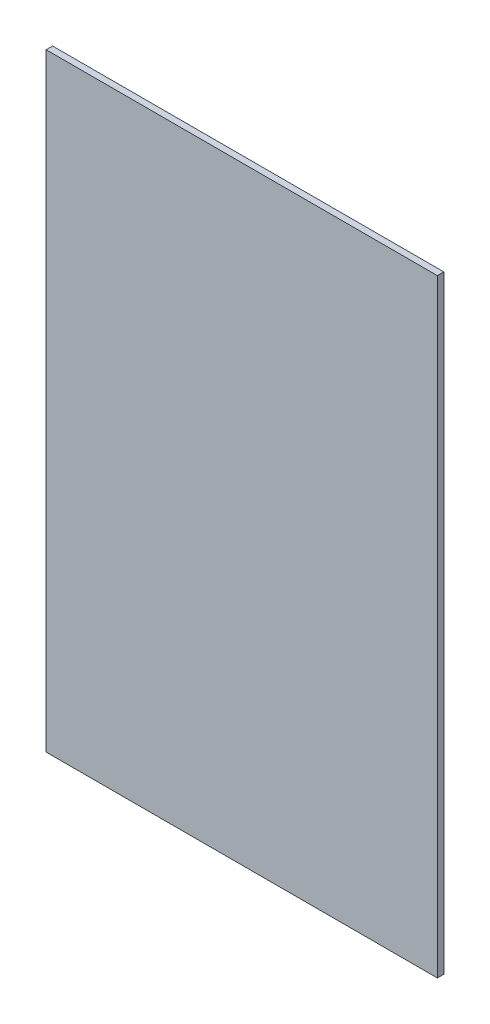
from build123d import *

# Parameters (mm, degrees)
CROQUIS1_W              = 604.7
CROQUIS1_H              = 940
SALIENTE_EXTRUIR1_DEPTH = 10


with BuildPart() as part:
    # Croquis1 → Saliente-Extruir1 (new body)
    with BuildSketch(Plane.XY):
        Rectangle(CROQUIS1_W, CROQUIS1_H)
    extrude(amount=SALIENTE_EXTRUIR1_DEPTH)


solid = part.part
